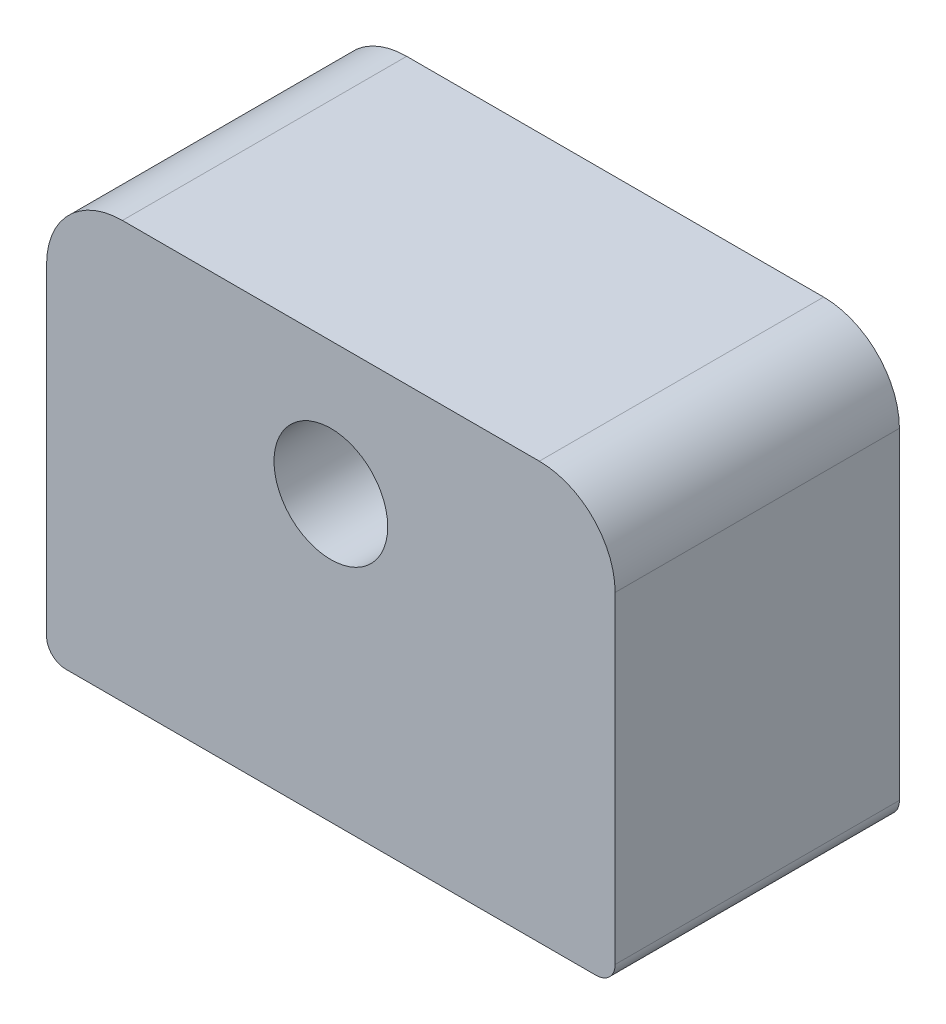
from build123d import *

# Parameters (mm, degrees)
ESQUISSE1_W             = 15
ESQUISSE1_H             = 11
BOSS_EXTRU_1_DEPTH      = 7.5
ESQUISSE2_R             = 1.5
ENL_V_MAT_EXTRU_1_DEPTH = 12.947803145
CONG_1_R                = 2
CONG_2_R                = 0.5


with BuildPart() as part:
    # Esquisse1 → Boss.-Extru.1 (new body)
    with BuildSketch(Plane.XY):
        Rectangle(ESQUISSE1_W, ESQUISSE1_H)
    extrude(amount=BOSS_EXTRU_1_DEPTH)

    # Esquisse2 → Enlèv. mat.-Extru.1 (cut, through all)
    with BuildSketch(Plane.XY.offset(7.5)):
        with Locations((0, 2)):
            Circle(ESQUISSE2_R)
    extrude(amount=-ENL_V_MAT_EXTRU_1_DEPTH, mode=Mode.SUBTRACT)

    # Congé1
    cong_1_edges = [part.edges().sort_by_distance(p)[0] for p in [
        (-7.5, 5.5, 3.75),
        (7.5, 5.5, 3.75),
    ]]
    fillet(cong_1_edges, radius=CONG_1_R)

    # Congé2
    cong_2_edges = [part.edges().sort_by_distance(p)[0] for p in [
        (7.5, -5.5, 3.75),
        (-7.5, -5.5, 3.75),
    ]]
    fillet(cong_2_edges, radius=CONG_2_R)


solid = part.part
